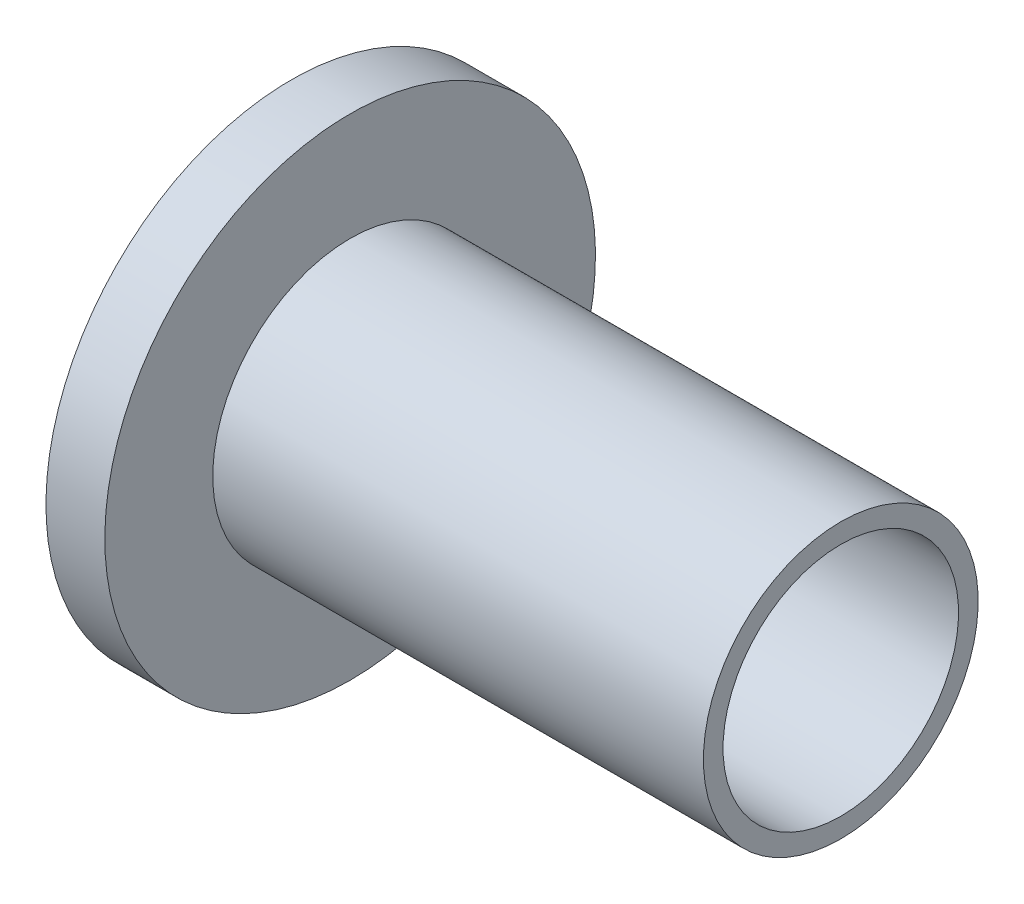
from build123d import *

# Parameters (mm, degrees)
CUT_EXTRUDE1_REACH = 68.227
SKETCH4_W          = 8
SKETCH4_H          = 13


with BuildPart() as part:
    # Sketch1 → Revolve1 (revolve)
    with BuildSketch(Plane.XY, mode=Mode.PRIVATE) as revolve1_sk:
        Polygon((0, 25), (0, 10), (19, 10), (19, 12), (56, 12), (56, 14), (6, 14), (6, 25), align=None)
    revolve(revolve1_sk.sketch.rotate(Axis((-64.900117457, 0, 0), (1, 0, 0)), 180), axis=Axis((-64.900117457, 0, 0), (1, 0, 0)))

    # Sketch4 → Cut-Extrude1 (cut, up to next)
    with BuildSketch(Plane(origin=(0, 0, 0), x_dir=(1, 0, 0), z_dir=(0, 1, 0)), mode=Mode.PRIVATE) as cut_extrude1_sk1:
        with Locations((15, 0)):
            Rectangle(SKETCH4_W, SKETCH4_H)
    cut_extrude1_tool1 = extrude(cut_extrude1_sk1.sketch, amount=-CUT_EXTRUDE1_REACH, mode=Mode.PRIVATE) & part.part
    add(cut_extrude1_tool1.solids().sort_by_distance((15, 0, 0))[0], mode=Mode.SUBTRACT)


solid = part.part
